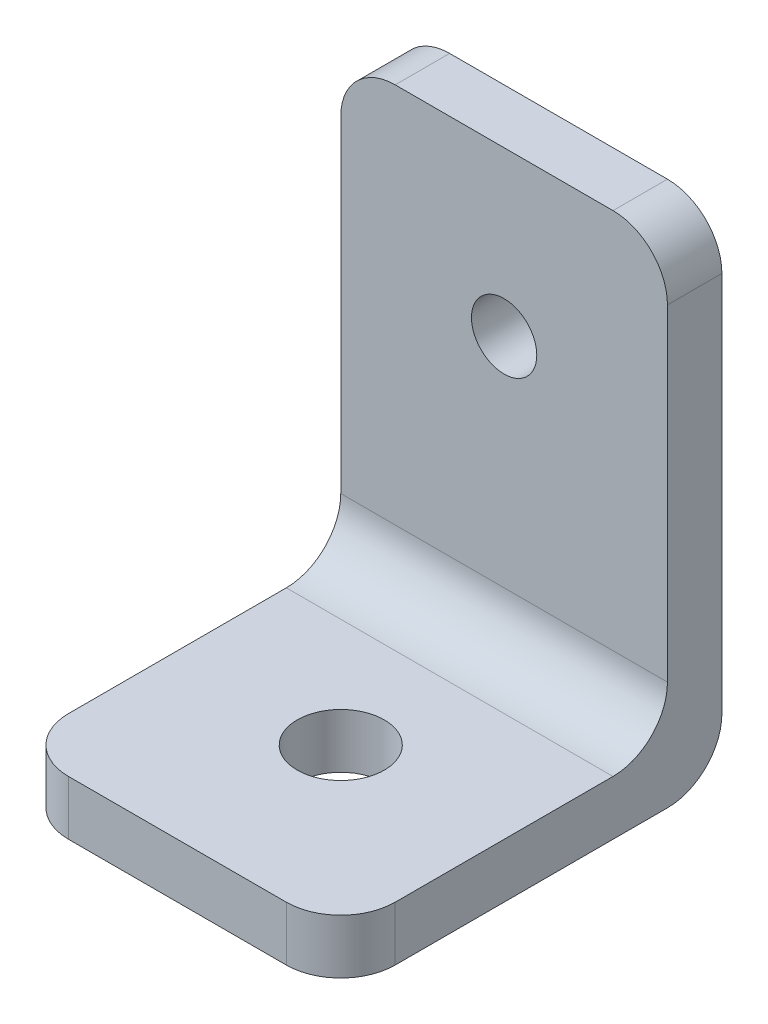
from build123d import *

# Parameters (mm, degrees)
SKETCH1_W           = 30
SKETCH1_H           = 45
SKETCH1_R           = 3
BOSS_EXTRUDE1_DEPTH = 5
SKETCH2_W           = 30
SKETCH2_H           = 5
BOSS_EXTRUDE2_DEPTH = 30
SKETCH3_R           = 4
CUT_EXTRUDE1_DEPTH  = 30
FILLET1_R           = 5


with BuildPart() as part:
    # Sketch1 → Boss-Extrude1 (new body)
    with BuildSketch(Plane.XY):
        with Locations((15, 22.5)):
            Rectangle(SKETCH1_W, SKETCH1_H)
        with Locations((15, 30)):
            Circle(SKETCH1_R, mode=Mode.SUBTRACT)
    extrude(amount=BOSS_EXTRUDE1_DEPTH)

    # Sketch2 → Boss-Extrude2 (add)
    with BuildSketch(Plane.XY.offset(5)):
        with Locations((15, 2.5)):
            Rectangle(SKETCH2_W, SKETCH2_H)
    extrude(amount=BOSS_EXTRUDE2_DEPTH)

    # Sketch3 → Cut-Extrude1 (cut)
    with BuildSketch(Plane(origin=(0, 5, 0), x_dir=(1, 0, 0), z_dir=(0, 1, 0))):
        with Locations(Location((15, -20, 0), (0, 0, 270))):
            Circle(SKETCH3_R)
    extrude(amount=-CUT_EXTRUDE1_DEPTH, mode=Mode.SUBTRACT)

    # Fillet1
    fillet1_edges = [part.edges().sort_by_distance(p)[0] for p in [
        (15, 5, 5),
        (0, 2.5, 35),
        (30, 2.5, 35),
        (15, 0, 0),
        (0, 45, 2.5),
        (30, 45, 2.5),
    ]]
    fillet(fillet1_edges, radius=FILLET1_R)


solid = part.part
